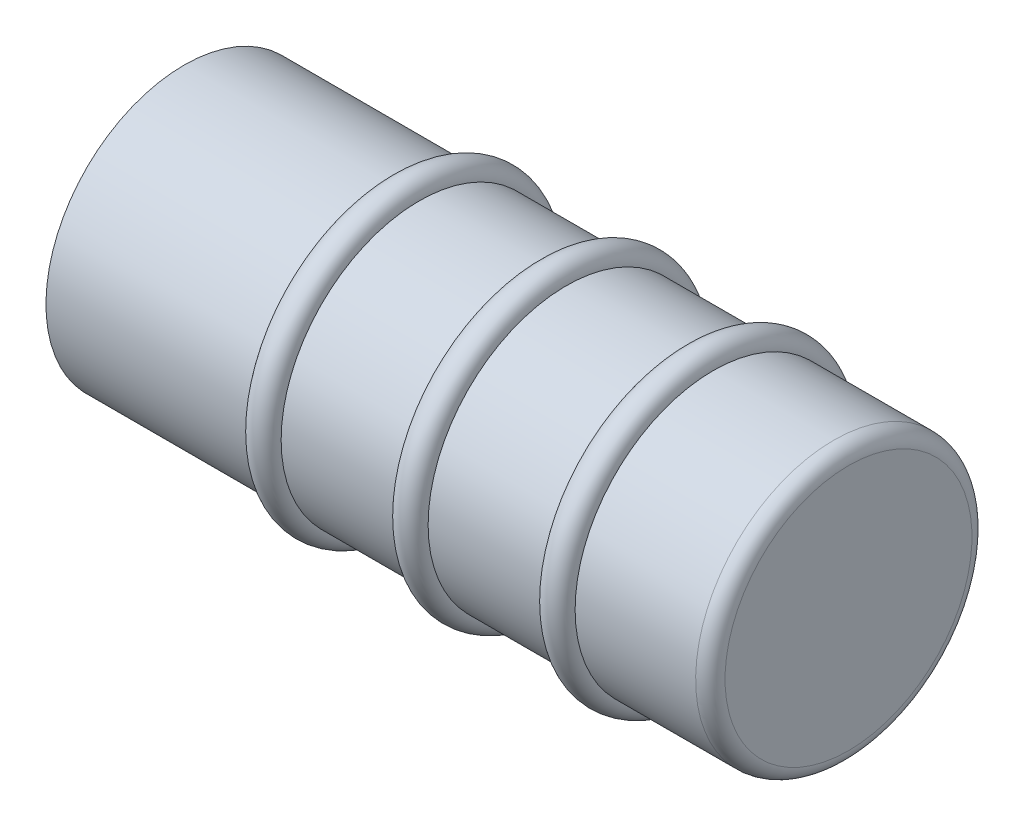
from build123d import *

# Parameters (mm, degrees)
SKETCH2_R       = 0.5
LPATTERN1_COUNT = 3
LPATTERN1_PITCH = 5


with BuildPart() as part:
    # Sketch1 → Revolve1 (revolve)
    with BuildSketch(Plane.XY):
        with BuildLine():
            Line((-22.6, 4.7), (-22.6, 0))
            Line((-22.6, 0), (0, 0))
            Line((0, 0), (0, 4.2))
            ThreePointArc((0, 4.2), (-0.146446609, 4.553553391), (-0.5, 4.7))
            Line((-0.5, 4.7), (-22.6, 4.7))
        make_face()
    revolve(axis=Axis((0, 0, 0), (-1, 0, 0)))

    # Sketch2 → Revolve2 (revolve)
    with BuildSketch(Plane.XY):
        with Locations((-15.1, 4.7)):
            Circle(SKETCH2_R)
    revolve2 = revolve(axis=Axis((-22.6, 0, 0), (1, 0, 0)))

    # LPattern1: Revolve2 ×3
    with Locations(*[(i * LPATTERN1_PITCH, 0, 0) for i in range(1, LPATTERN1_COUNT)]):
        add(revolve2)


solid = part.part
